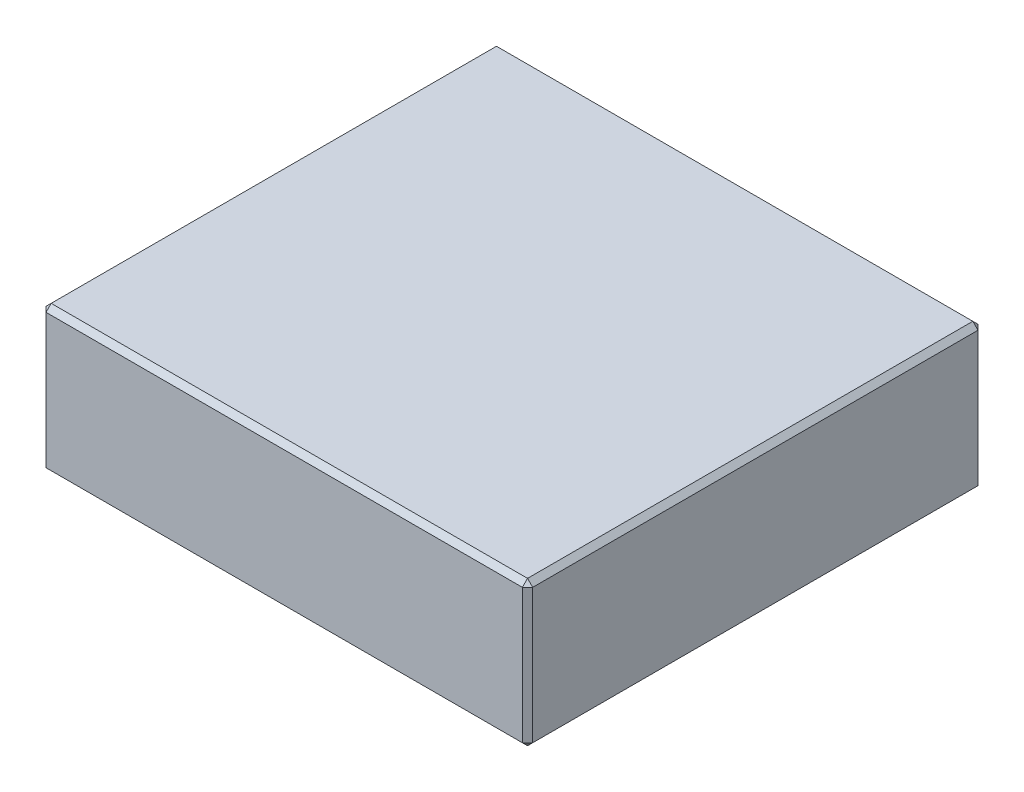
from build123d import *

# Parameters (mm, degrees)
SKETCH_1_W      = 47
SKETCH_1_H      = 44
EXTRUDE_1_DEPTH = 14
CHAMFER_1_SIZE  = 0.5


with BuildPart() as part:
    # 草图1 → 凸台-拉伸1 (new body)
    with BuildSketch(Plane(origin=(0, 0, 0), x_dir=(1, 0, 0), z_dir=(0, 1, 0))):
        Rectangle(SKETCH_1_W, SKETCH_1_H)
    extrude(amount=EXTRUDE_1_DEPTH)

    # 倒角1
    chamfer_1_edges = [part.edges().sort_by_distance(p)[0] for p in [
        (-23.5, 14, 0),
        (0, 14, 22),
        (23.5, 14, 0),
        (0, 0, 22),
        (-23.5, 0, 0),
        (0, 0, -22),
        (23.5, 0, 0),
        (23.5, 7, 22),
        (-23.5, 7, 22),
        (-23.5, 7, -22),
        (23.5, 7, -22),
        (0, 14, -22),
    ]]
    chamfer(chamfer_1_edges, length=CHAMFER_1_SIZE)


solid = part.part
